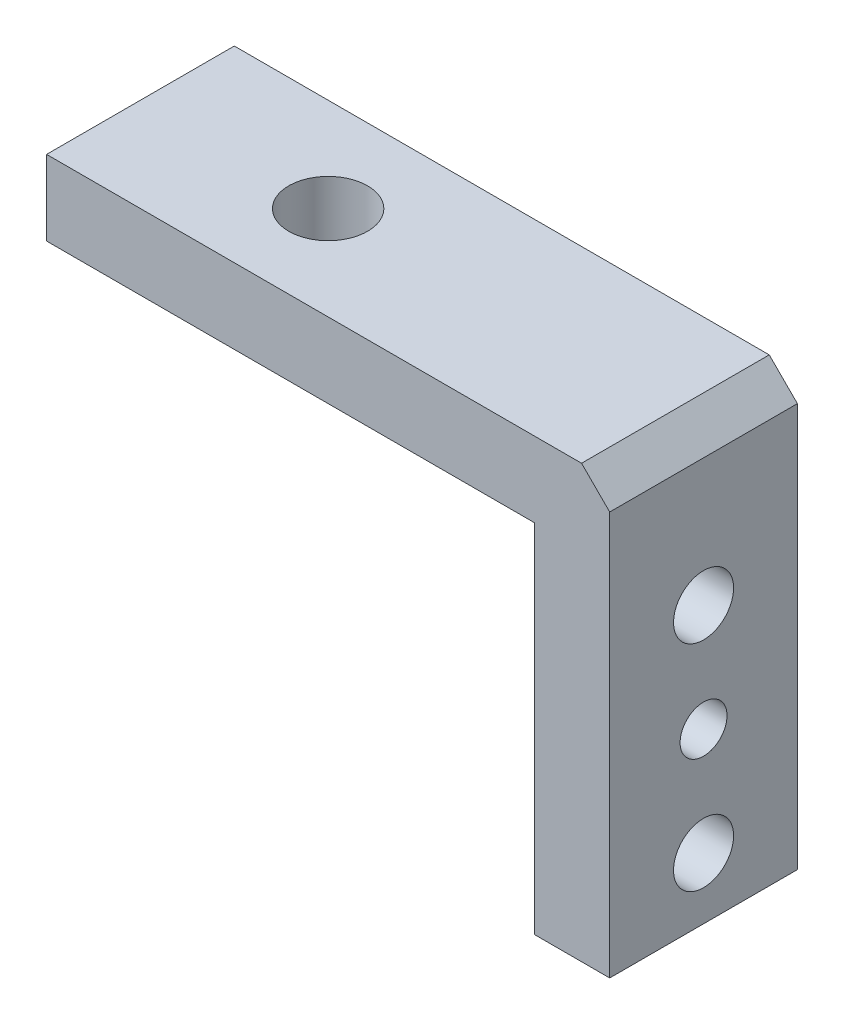
from build123d import *

# Parameters (mm, degrees)
SKETCH1_W                          = 30
SKETCH1_H                          = 23
BOSS_EXTRUDE1_DEPTH                = 5
SKETCH2_W                          = 26
SKETCH2_H                          = 19
CUT_EXTRUDE1_DEPTH                 = 22.38340478
CHAMFER1_SIZE                      = 1.5
TAPPED_HOLE_FOR_M4X0_7_HELICOIL1_D = 4.2
M3_CLEARANCE_HOLE1_D               = 3.2
M3_TAPPED_HOLE1_D                  = 2.5


with BuildPart() as part:
    # Sketch1 → Boss-Extrude1 (new, symmetric)
    with BuildSketch(Plane.XY):
        Rectangle(SKETCH1_W, SKETCH1_H)
    extrude(amount=BOSS_EXTRUDE1_DEPTH, both=True)

    # Sketch2 → Cut-Extrude1 (cut, through all)
    with BuildSketch(Plane.XY.offset(5)):
        with Locations((-2, -2)):
            Rectangle(SKETCH2_W, SKETCH2_H)
    extrude(amount=-CUT_EXTRUDE1_DEPTH, mode=Mode.SUBTRACT)

    # Chamfer1
    chamfer1_edges = [part.edges().sort_by_distance(p)[0] for p in [
        (15, 11.5, 0),
    ]]
    chamfer(chamfer1_edges, length=CHAMFER1_SIZE)

    # Tapped Hole for M4x0.7 Helicoil1 (through all)
    with Locations(Plane(origin=(0, 11.5, 0), x_dir=(1, 0, 0), z_dir=(0, 1, 0))):
        with Locations((-5, 0)):
            Hole(TAPPED_HOLE_FOR_M4X0_7_HELICOIL1_D / 2)

    # M3 Clearance Hole1 (through all)
    with Locations(Plane(origin=(15, 0, 0), x_dir=(0, 0, -1), z_dir=(1, 0, 0))):
        with Locations((0, -8.232), (0, 3.198)):
            Hole(M3_CLEARANCE_HOLE1_D / 2)

    # M3 Tapped Hole1 (through all)
    with Locations(Plane(origin=(15, 0, 0), x_dir=(0, 0, -1), z_dir=(1, 0, 0))):
        with Locations((0, -2.517)):
            Hole(M3_TAPPED_HOLE1_D / 2)


solid = part.part
